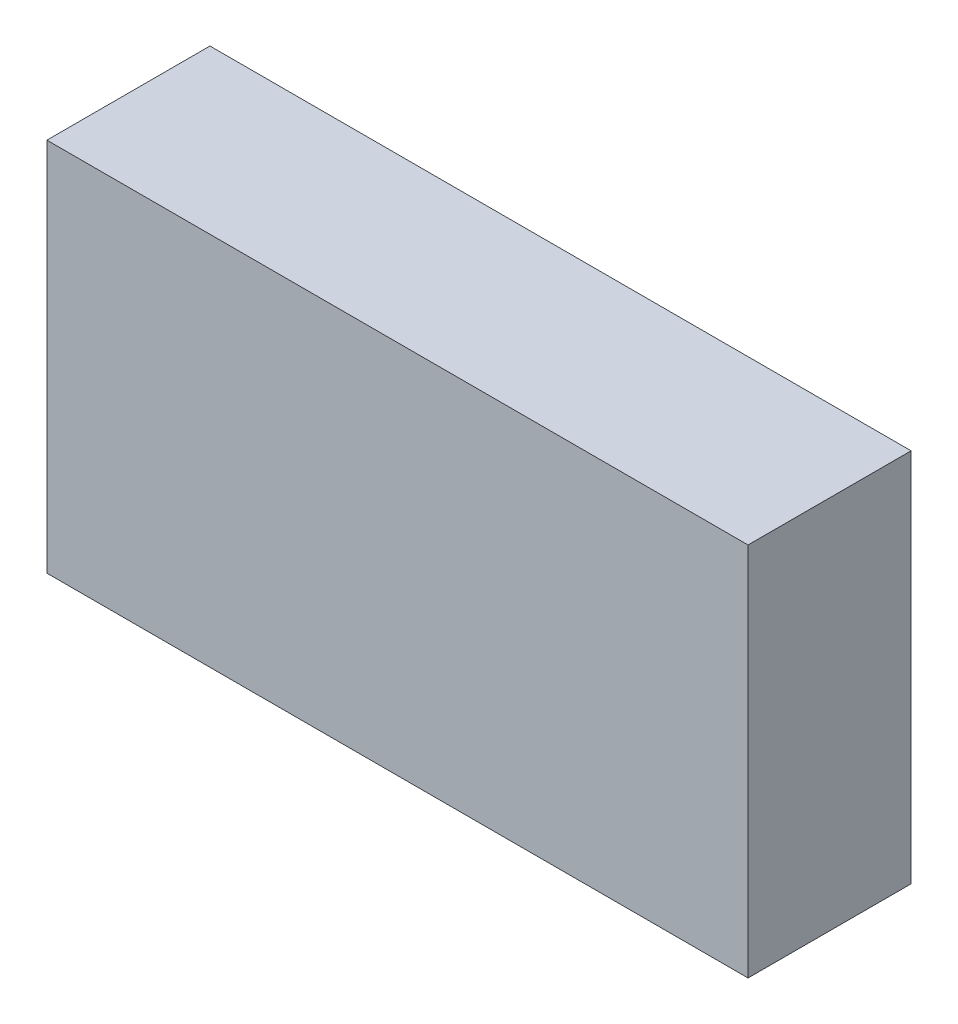
from build123d import *

# Parameters (mm, degrees)
SZKIC1_W                    = 215
SZKIC1_H                    = 115
DODANIE_WYCI_GNI_CIE1_DEPTH = 50


with BuildPart() as part:
    # Szkic1 → Dodanie-wyciągnięcie1 (new body)
    with BuildSketch(Plane.XY):
        with Locations((107.5, 57.5)):
            Rectangle(SZKIC1_W, SZKIC1_H)
    extrude(amount=DODANIE_WYCI_GNI_CIE1_DEPTH)


solid = part.part
